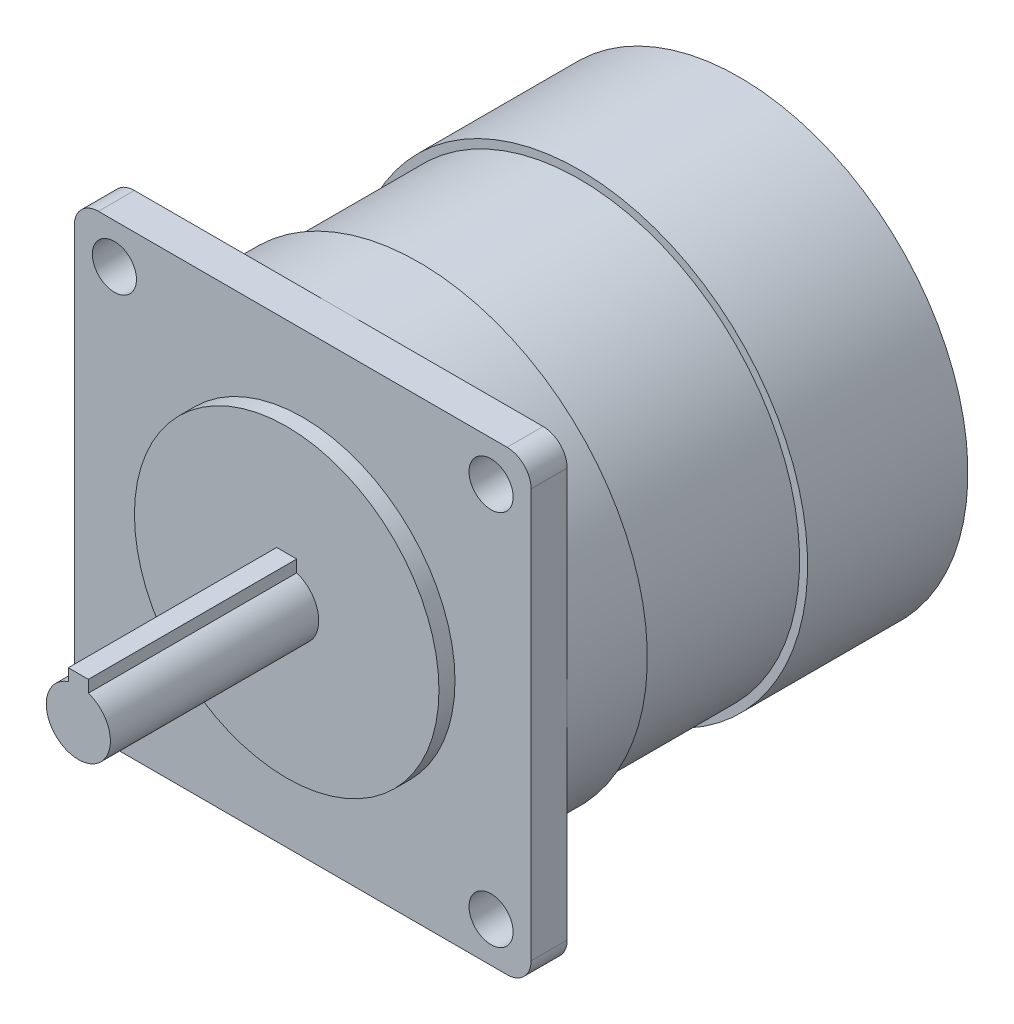
from build123d import *

# Parameters (mm, degrees)
SKETCH_1_W          = 57
SKETCH_1_H          = 57
EXTRUDE_1_DEPTH     = 4.5
FILLET_1_R          = 3
SKETCH_2_R          = 19
EXTRUDE_2_DEPTH     = 2
EXTRUDE_3_DEPTH     = 26
SKETCH_4_R          = 2.75
CUT_EXTRUDE_1_DEPTH = 15
SKETCH_5_R          = 28.5
EXTRUDE_4_DEPTH     = 10
SKETCH_6_R          = 27.5
EXTRUDE_5_DEPTH     = 20
SKETCH_7_R          = 28.5
EXTRUDE_6_DEPTH     = 20


with BuildPart() as part:
    # 草图1 → 凸台-拉伸1 (new body)
    with BuildSketch(Plane.XY):
        Rectangle(SKETCH_1_W, SKETCH_1_H)
    extrude(amount=EXTRUDE_1_DEPTH)

    # 圆角1
    fillet_1_edges = [part.edges().sort_by_distance(p)[0] for p in [
        (28.5, -28.5, 2.25),
        (-28.5, -28.5, 2.25),
        (-28.5, 28.5, 2.25),
        (28.5, 28.5, 2.25),
    ]]
    fillet(fillet_1_edges, radius=FILLET_1_R)

    # 草图2 → 凸台-拉伸2 (add)
    with BuildSketch(Plane.XY.offset(4.5)):
        Circle(SKETCH_2_R)
    extrude(amount=EXTRUDE_2_DEPTH)

    # 草图3 → 凸台-拉伸3 (add)
    with BuildSketch(Plane.XY.offset(6.5)):
        with BuildLine():
            Line((-1.25, 3.799671038), (-1.25, 5.299671038))
            Line((-1.25, 5.299671038), (1.25, 5.299671038))
            Line((1.25, 5.299671038), (1.25, 3.799671038))
            ThreePointArc((1.25, 3.799671038), (0, -4), (-1.25, 3.799671038))
        make_face()
    extrude(amount=EXTRUDE_3_DEPTH)

    # 草图4 → 切除-拉伸1 (cut)
    with BuildSketch(Plane.XY.offset(4.5)):
        with Locations((-23.5, 23.5)):
            Circle(SKETCH_4_R)
        with Locations((23.5, 23.5)):
            Circle(SKETCH_4_R)
        with Locations((-23.5, -23.5)):
            Circle(SKETCH_4_R)
        with Locations((23.5, -23.5)):
            Circle(SKETCH_4_R)
    extrude(amount=-CUT_EXTRUDE_1_DEPTH, mode=Mode.SUBTRACT)

    # 草图5 → 凸台-拉伸4 (add)
    with BuildSketch(Plane(origin=(0, 0, 0), x_dir=(-1, 0, 0), z_dir=(0, 0, -1))):
        Circle(SKETCH_5_R)
    extrude(amount=EXTRUDE_4_DEPTH)

    # 草图6 → 凸台-拉伸5 (add)
    with BuildSketch(Plane(origin=(0, 0, -10), x_dir=(-1, 0, 0), z_dir=(0, 0, -1))):
        Circle(SKETCH_6_R)
    extrude(amount=EXTRUDE_5_DEPTH)

    # 草图7 → 凸台-拉伸6 (add)
    with BuildSketch(Plane(origin=(0, 0, -30), x_dir=(-1, 0, 0), z_dir=(0, 0, -1))):
        Circle(SKETCH_7_R)
    extrude(amount=EXTRUDE_6_DEPTH)


solid = part.part
